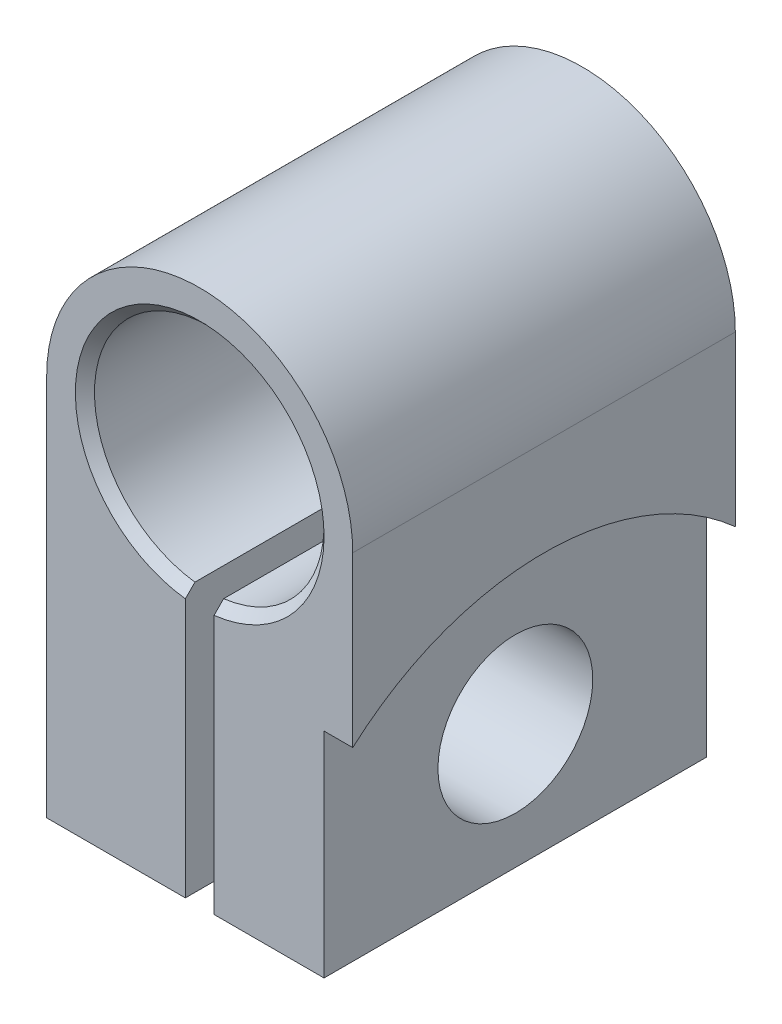
from build123d import *

# Parameters (mm, degrees)
ESTRUSIONE_ESTRUSIONE1_DEPTH = 20
SCHIZZO3_R                   = 6
TAGLIO_ESTRUSIONE1_DEPTH     = 26.699370322
SCHIZZO4_W                   = 1.5
SCHIZZO4_H                   = 14.04705955
TAGLIO_ESTRUSIONE2_DEPTH     = 26.699370322
SCHIZZO5_R                   = 15
TAGLIO_ESTRUSIONE3_DEPTH     = 1.5
TAGLIO_ESTRUSIONE4_REACH     = 30.403
SCHIZZO6_R                   = 4.046600507
SMUSSO2_SIZE                 = 0.5
SMUSSO3_SIZE                 = 0.5


with BuildPart() as part:
    # Schizzo2 → Estrusione-Estrusione1 (new body)
    with BuildSketch(Plane.XY):
        with BuildLine():
            Line((8, -13.983665425), (-8, -13.983665425))
            Line((-8, -13.983665425), (-8, 6.016334575))
            ThreePointArc((-8, 6.016334575), (0, 14.016334575), (8, 6.016334575))
            Line((8, 6.016334575), (8, -13.983665425))
        make_face()
    extrude(amount=-ESTRUSIONE_ESTRUSIONE1_DEPTH)

    # Schizzo3 → Taglio-Estrusione1 (cut, through all)
    with BuildSketch(Plane.XY):
        with Locations((0, 6.016334575)):
            Circle(SCHIZZO3_R)
    extrude(amount=-TAGLIO_ESTRUSIONE1_DEPTH, mode=Mode.SUBTRACT)

    # Schizzo4 → Taglio-Estrusione2 (cut, through all)
    with BuildSketch(Plane.XY):
        with Locations((0, -6.96013565)):
            Rectangle(SCHIZZO4_W, SCHIZZO4_H)
    extrude(amount=-TAGLIO_ESTRUSIONE2_DEPTH, mode=Mode.SUBTRACT)

    # Schizzo5 → Taglio-Estrusione3 (cut)
    with BuildSketch(Plane(origin=(8, 0, 0), x_dir=(0, 0, -1), z_dir=(1, 0, 0))):
        with Locations((10, -13.983665425)):
            Circle(SCHIZZO5_R)
    extrude(amount=-TAGLIO_ESTRUSIONE3_DEPTH, mode=Mode.SUBTRACT)

    # Schizzo6 → Taglio-Estrusione4 (cut, up to next)
    with BuildSketch(Plane(origin=(6.5, 0, 0), x_dir=(0, 0, -1), z_dir=(1, 0, 0)), mode=Mode.PRIVATE) as taglio_estrusione4_sk1:
        with Locations((10, -7.483665425)):
            Circle(SCHIZZO6_R)
    taglio_estrusione4_tool1 = extrude(taglio_estrusione4_sk1.sketch, amount=-TAGLIO_ESTRUSIONE4_REACH, mode=Mode.PRIVATE) & part.part
    add(taglio_estrusione4_tool1.solids().sort_by_distance((6.5, -7.483665, -10))[0], mode=Mode.SUBTRACT)

    # Smusso2
    smusso2_edges = [part.edges().sort_by_distance(p)[0] for p in [
        (0, 12.016334575, 0),
    ]]
    chamfer(smusso2_edges, length=SMUSSO2_SIZE)

    # Smusso3
    smusso3_edges = [part.edges().sort_by_distance(p)[0] for p in [
        (0, 12.016334575, -20),
    ]]
    chamfer(smusso3_edges, length=SMUSSO3_SIZE)


solid = part.part
